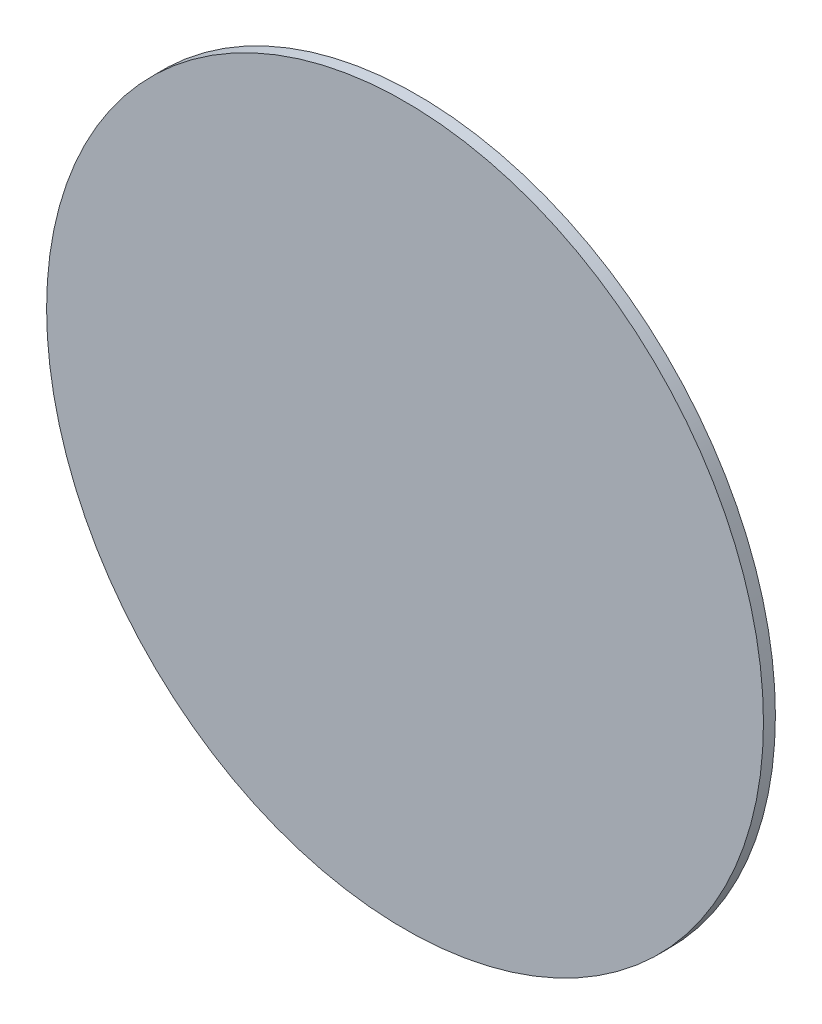
from build123d import *

# Parameters (mm, degrees)
SKETCH1_R           = 76.2
BOSS_EXTRUDE1_DEPTH = 2.54


with BuildPart() as part:
    # Sketch1 → Boss-Extrude1 (new body)
    with BuildSketch(Plane.XY):
        with Locations((16.02400921, 22.154475414)):
            Circle(SKETCH1_R)
    extrude(amount=BOSS_EXTRUDE1_DEPTH)


solid = part.part
